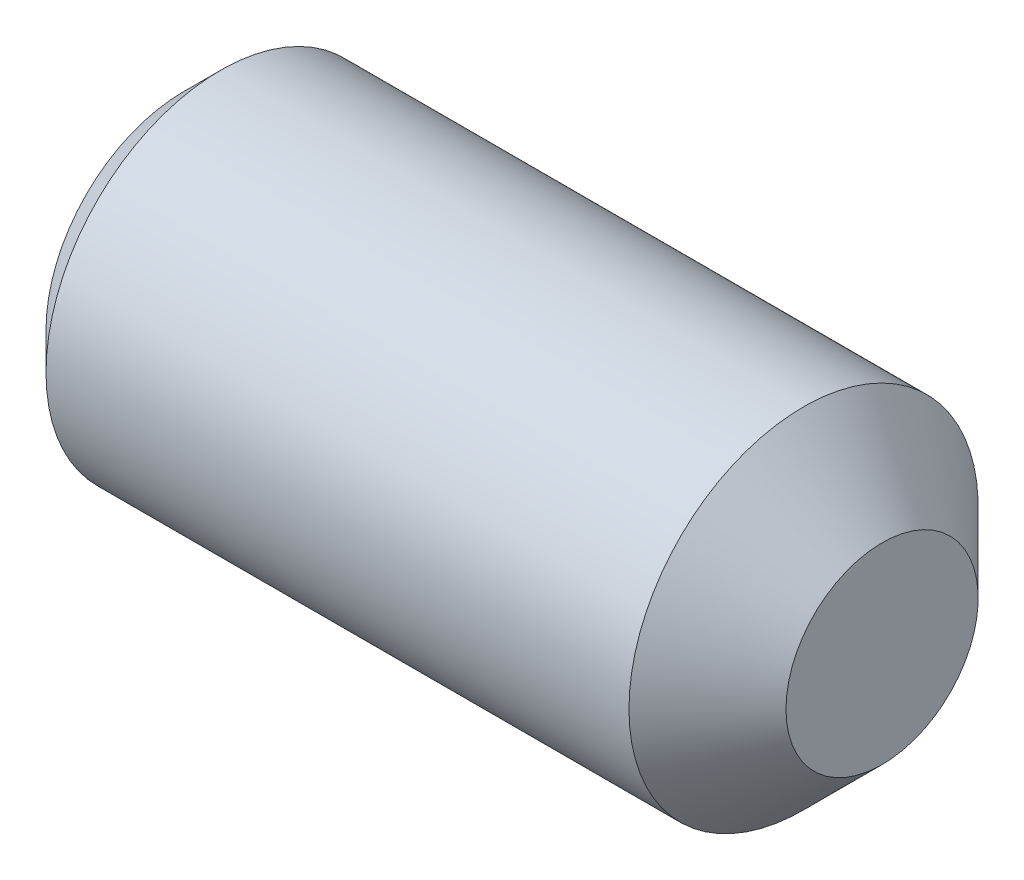
from build123d import *

# Parameters (mm, degrees)
HEX_2_DEPTH = 3.9624


with BuildPart() as part:
    # BodySke → BaseBody (revolve)
    with BuildSketch(Plane.XY, mode=Mode.PRIVATE) as basebody_sk:
        Polygon((0, 0), (0, 3.12928), (0.83947, 3.96875), (14.09065, 3.96875), (15.875, 2.1844), (15.875, 0), align=None)
    revolve(basebody_sk.sketch.rotate(Axis((-12.7, 0, 0), (1, 0, 0)), 90), axis=Axis((-12.7, 0, 0), (1, 0, 0)))

    # Sketch2 → Hex 2 (cut)
    with BuildSketch(Plane.ZY):
        Polygon((1.145312823, 1.98374), (-1.145312823, 1.98374), (-2.290625646, 0), (-1.145312823, -1.98374), (1.145312823, -1.98374), (2.290625646, 0), align=None)
    extrude(amount=-HEX_2_DEPTH, mode=Mode.SUBTRACT)


solid = part.part
